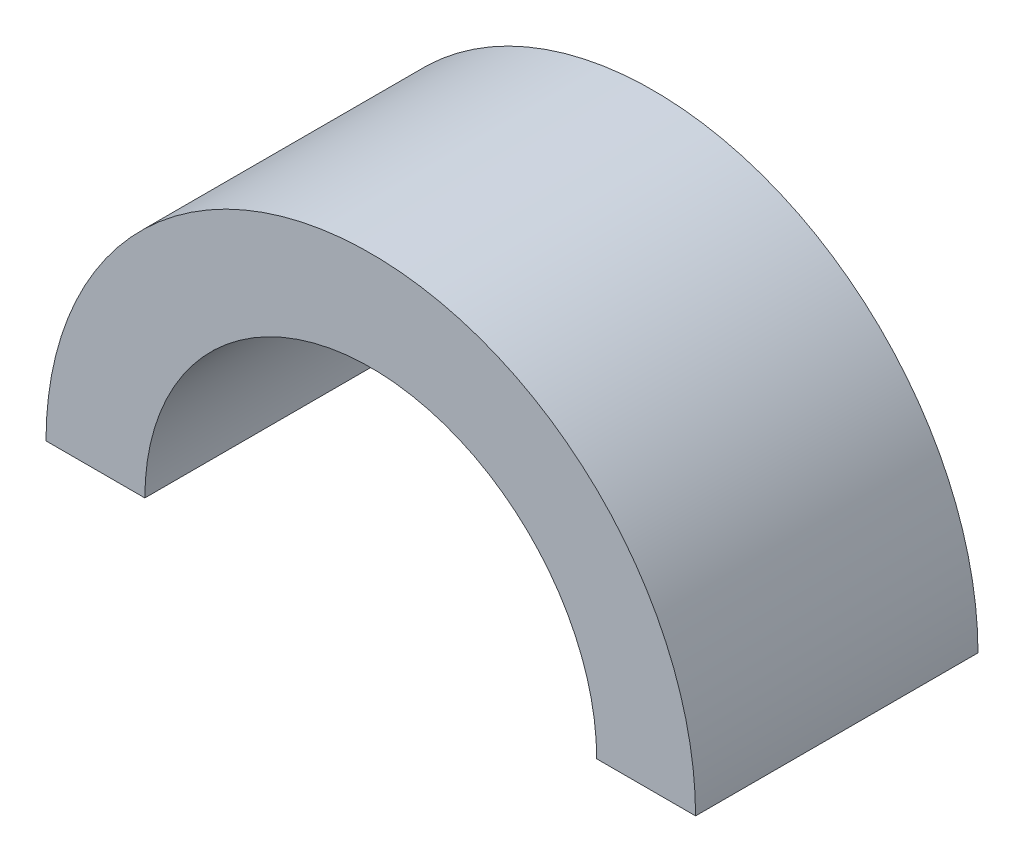
from build123d import *

# Parameters (mm, degrees)
PROFILE_DEPTH = 20


with BuildPart() as part:
    # Sketch1 → Profile (new body)
    with BuildSketch(Plane.XY):
        with BuildLine():
            Line((46, 23), (39, 23))
            ThreePointArc((39, 23), (23, 39), (7, 23))
            Line((7, 23), (0, 23))
            ThreePointArc((0, 23), (23, 46), (46, 23))
        make_face()
    extrude(amount=PROFILE_DEPTH)


solid = part.part
